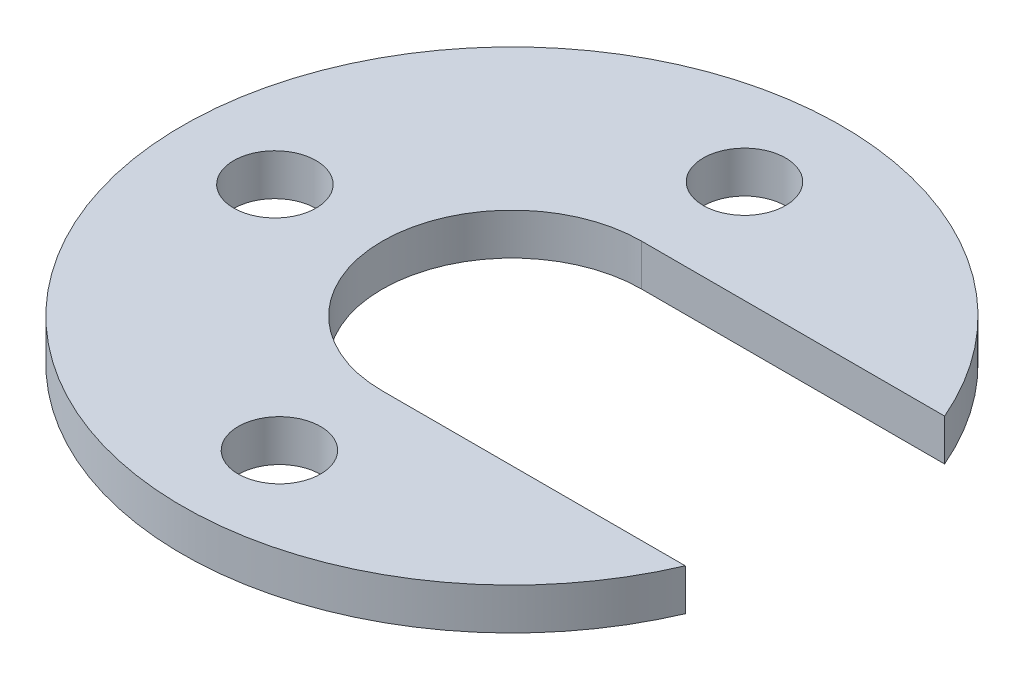
from build123d import *

# Parameters (mm, degrees)
IZIM1_R                     = 4.960788644
Y_KSEKLIK_EKSTR_ZYON1_DEPTH = 5


with BuildPart() as part:
    # Çizim1 → Yükseklik-Ekstrüzyon1 (new body)
    with BuildSketch(Plane(origin=(0, 0, 0), x_dir=(1, 0, 0), z_dir=(0, 1, 0))):
        with BuildLine():
            ThreePointArc((0, -15.612956291), (-15.612956291, 0), (0, 15.612956291))
            Line((0, 15.612956291), (36.486144355, 15.612956291))
            ThreePointArc((36.486144355, 15.612956291), (-39.686309151, 0), (36.486144355, -15.612956291))
            Line((36.486144355, -15.612956291), (0, -15.612956291))
        make_face()
        with Locations(Location((-28, -0.544306251, 0), (0, 0, 270))):
            Circle(IZIM1_R, mode=Mode.SUBTRACT)
        with Locations(Location((0, -28, 0), (0, 0, 270))):
            Circle(IZIM1_R, mode=Mode.SUBTRACT)
        with Locations(Location((0, 28, 0), (0, 0, 270))):
            Circle(IZIM1_R, mode=Mode.SUBTRACT)
    extrude(amount=Y_KSEKLIK_EKSTR_ZYON1_DEPTH)


solid = part.part
